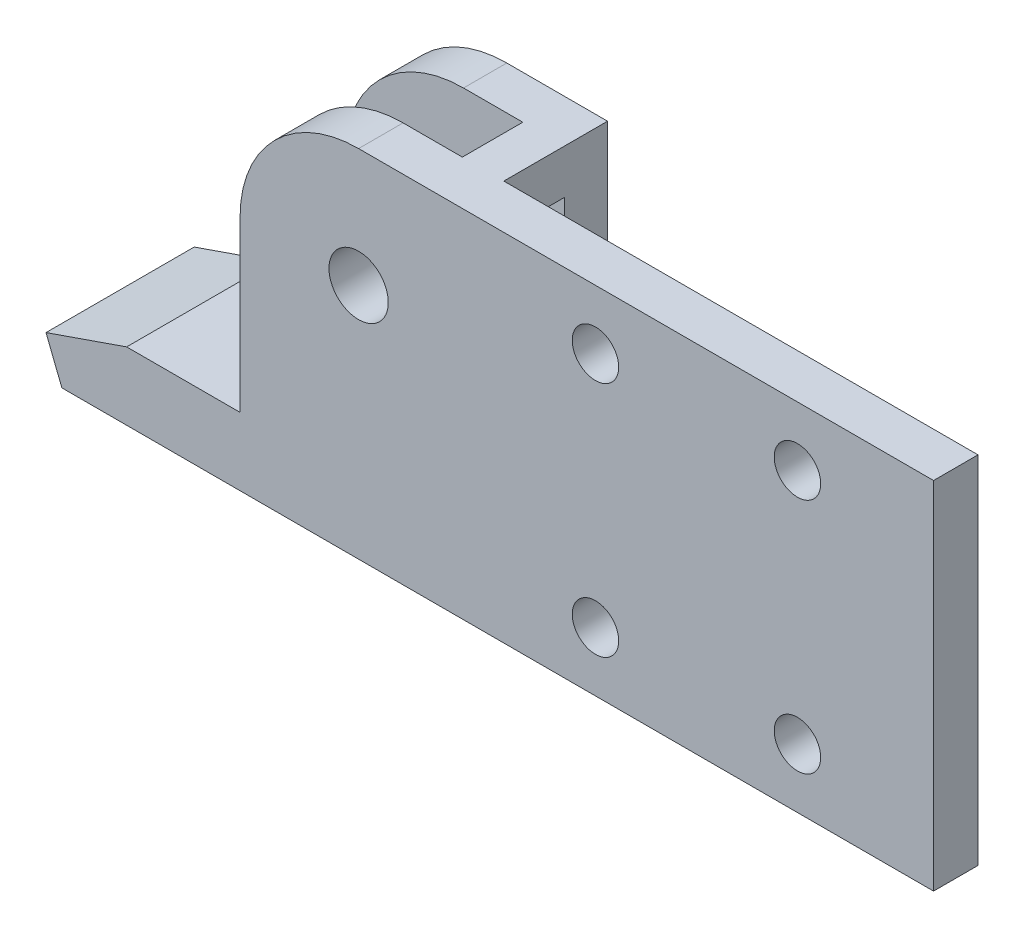
from build123d import *

# Parameters (mm, degrees)
SKETCH2_R                  = 3.175
BOSS_EXTRUDE1_DEPTH        = 4.7625
BOSS_EXTRUDE2_START        = 11.1125
BOSS_EXTRUDE2_DEPTH        = 11.1125
SKETCH12_W                 = 6.477
SKETCH12_H                 = 21.856650617
CUT_EXTRUDE1_DEPTH         = 24.13
SKETCH12_3_W               = 6.477
SKETCH12_3_H               = 4.7625
CUT_EXTRUDE2_DEPTH         = 19.05
TAP_DRILL_FOR_10_32_TAP1_D = 4.0386
F_10_CLEARANCE_HOLE2_D     = 4.9784


with BuildPart() as part:
    # Sketch2 → Boss-Extrude1 (new body)
    with BuildSketch(Plane.XY):
        with BuildLine():
            Line((-67.986186343, -228.533359856), (-69.686856366, -224.252380141))
            Line((-69.686856366, -224.252380141), (-61.0470258, -221.260552334))
            Line((-61.0470258, -221.260552334), (-48.895, -221.260552334))
            Line((-48.895, -221.260552334), (-48.895, -203.133359856))
            ThreePointArc((-48.895, -203.133359856), (-45.175256121, -194.153103735), (-36.195, -190.433359856))
            Line((-36.195, -190.433359856), (25.4, -190.433359856))
            Line((25.4, -190.433359856), (25.4, -228.533359856))
            Line((25.4, -228.533359856), (-67.986186343, -228.533359856))
        make_face()
        with Locations((-36.195, -203.133359856)):
            Circle(SKETCH2_R, mode=Mode.SUBTRACT)
    extrude(amount=BOSS_EXTRUDE1_DEPTH)

    # Sketch11 → Boss-Extrude2 (add)
    with BuildSketch(Plane(origin=(0, 0, 0), x_dir=(-1, 0, 0), z_dir=(0, 0, -1)).offset(BOSS_EXTRUDE2_START)):
        with BuildLine():
            Line((25.4, -190.433359856), (25.4, -228.533359856))
            Line((25.4, -228.533359856), (67.986186343, -228.533359856))
            Line((67.986186343, -228.533359856), (69.686856366, -224.252380141))
            Line((69.686856366, -224.252380141), (61.0470258, -221.260552334))
            Line((61.0470258, -221.260552334), (48.895, -221.260552334))
            Line((48.895, -221.260552334), (48.895, -203.133359856))
            ThreePointArc((48.895, -203.133359856), (45.175256121, -194.153103735), (36.195, -190.433359856))
            Line((36.195, -190.433359856), (25.4, -190.433359856))
        make_face()
    extrude(amount=-BOSS_EXTRUDE2_DEPTH)

    # Sketch12 → Cut-Extrude1 (cut)
    with BuildSketch(Plane.ZY.offset(48.895)):
        with Locations((-3.2385, -206.124185165)):
            Rectangle(SKETCH12_W, SKETCH12_H)
    extrude(amount=-CUT_EXTRUDE1_DEPTH, mode=Mode.SUBTRACT)

    # Sketch12<3> → Cut-Extrude2 (cut)
    with BuildSketch(Plane.ZY.offset(48.895)):
        with Locations((-3.2385, -192.814609856)):
            Rectangle(SKETCH12_3_W, SKETCH12_3_H)
    extrude(amount=-CUT_EXTRUDE2_DEPTH, mode=Mode.SUBTRACT)

    # Tap Drill for #10-32 Tap1 (through all)
    with Locations(Plane.XY.offset(-6.477)):
        with Locations((-36.195, -203.133359856)):
            Hole(TAP_DRILL_FOR_10_32_TAP1_D / 2)

    # #10 Clearance Hole2 (through all)
    with Locations(Plane.XY.offset(4.7625)):
        with Locations((-10.8204, -196.783359856), (-10.8204, -222.183359856), (10.8204, -222.183359856), (10.8204, -196.783359856)):
            Hole(F_10_CLEARANCE_HOLE2_D / 2)


solid = part.part
